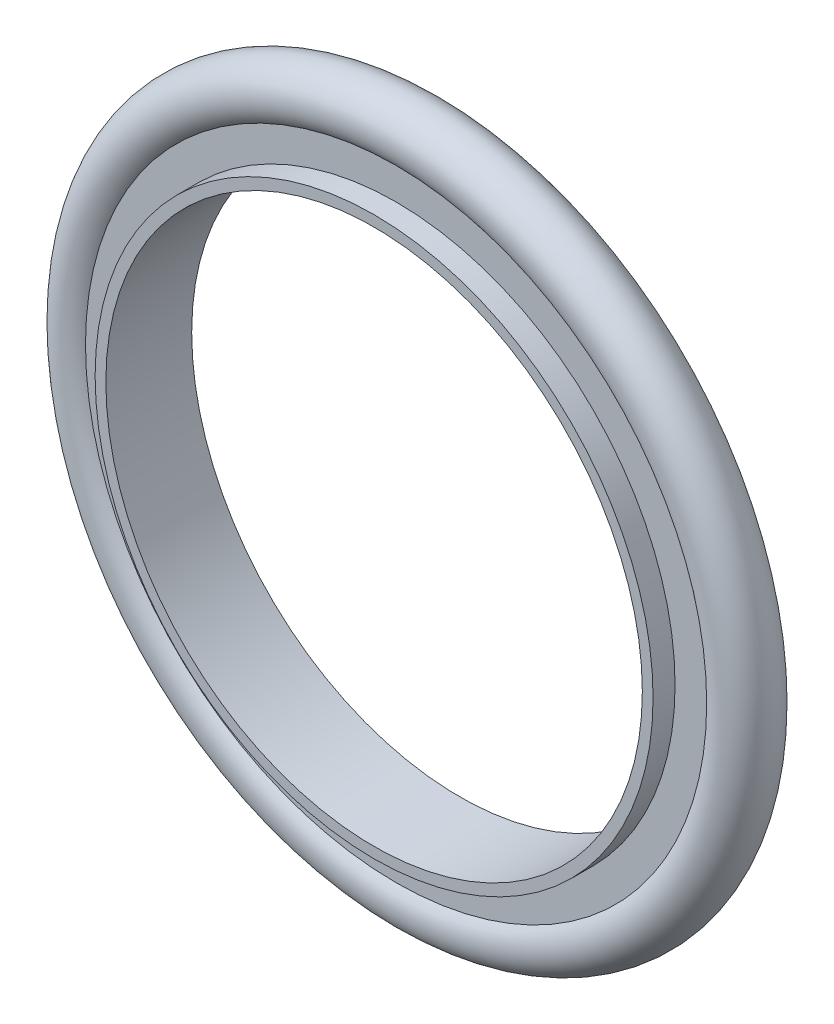
from build123d import *


with BuildPart() as part:
    # Sketch1 → Revolve1 (revolve)
    with BuildSketch(Plane(origin=(0, 0, 0), x_dir=(0, 0, -1), z_dir=(1, 0, 0)), mode=Mode.PRIVATE) as revolve1_sk:
        with BuildLine():
            Line((-4, 25), (4, 25))
            Line((4, 25), (4, 26))
            Line((4, 26), (1.95, 26))
            Line((1.95, 26), (1.95, 28.94745668))
            ThreePointArc((1.95, 28.94745668), (0, 33.391892525), (-1.95, 28.94745668))
            Line((-1.95, 28.94745668), (-1.95, 26))
            Line((-1.95, 26), (-4, 26))
            Line((-4, 26), (-4, 25))
        make_face()
    revolve(revolve1_sk.sketch.rotate(Axis((0, 0, -6.803273839), (0, 0, -1)), 90), axis=Axis((0, 0, -6.803273839), (0, 0, -1)))


solid = part.part
